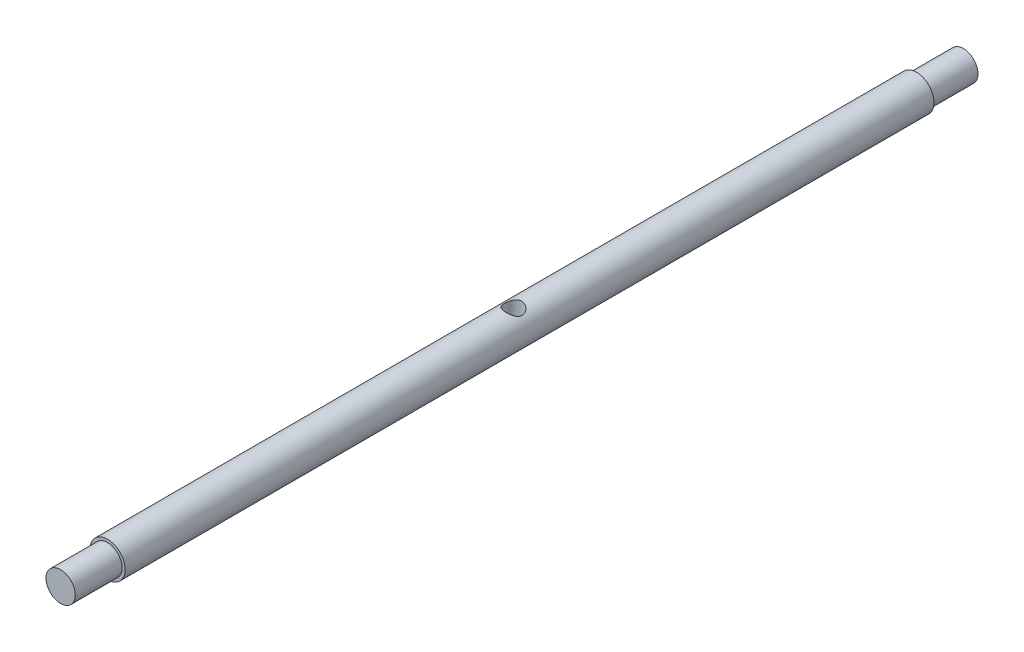
from build123d import *

# Parameters (mm, degrees)
SKETCH1_R                           = 3
BOSS_EXTRUDE1_DEPTH                 = 138
SKETCH2_R                           = 2.5
BOSS_EXTRUDE2_DEPTH                 = 8
BOSS_EXTRUDE3_START                 = 8
SKETCH3_R                           = 2.5
BOSS_EXTRUDE3_DEPTH                 = 8
CUT_EXTRUDE1_REACH                  = 148.062
CUT_EXTRUDE1_END_RADIUS             = 3
SKETCH4_R                           = 1.5
CUT_EXTRUDE1_DIRECTION_2_REACH      = 148.062
CUT_EXTRUDE1_DIRECTION_2_END_RADIUS = 3


with BuildPart() as part:
    # Sketch1 → Boss-Extrude1 (new body)
    with BuildSketch(Plane.XY):
        Circle(SKETCH1_R)
    extrude(amount=BOSS_EXTRUDE1_DEPTH)

    # Sketch2 → Boss-Extrude2 (add)
    with BuildSketch(Plane.XY.offset(138)):
        Circle(SKETCH2_R)
    extrude(amount=BOSS_EXTRUDE2_DEPTH)

    # Sketch3 → Boss-Extrude3 (add)
    with BuildSketch(Plane(origin=(0, 0, 0), x_dir=(-1, 0, 0), z_dir=(0, 0, -1)).offset(BOSS_EXTRUDE3_START)):
        with Locations(Location((0, 0, 0), (0, 0, 180))):
            Circle(SKETCH3_R)
    extrude(amount=-BOSS_EXTRUDE3_DEPTH)

    # Cut-Extrude1: up to this cylinder (the profile starts inside it)
    cut_extrude1_end = Plane(origin=(0, 0, 69), z_dir=(0, 0, -1)) * Cylinder(CUT_EXTRUDE1_END_RADIUS, 303.124, mode=Mode.PRIVATE)
    # Sketch4 → Cut-Extrude1 (cut, up to the surface)
    with BuildSketch(Plane(origin=(0, 0, 0), x_dir=(1, 0, 0), z_dir=(0, 1, 0)), mode=Mode.PRIVATE) as cut_extrude1_sk1:
        with Locations(Location((0.25, -69, 0), (0, 0, 270))):
            Circle(SKETCH4_R)
    cut_extrude1_tool1 = extrude(cut_extrude1_sk1.sketch, amount=-CUT_EXTRUDE1_REACH, mode=Mode.PRIVATE) & cut_extrude1_end
    add(cut_extrude1_tool1.solids().sort_by_distance((0.25, 0, 69))[0], mode=Mode.SUBTRACT)

    # Cut-Extrude1 direction 2: up to this cylinder (the profile starts inside it)
    cut_extrude1_direction_2_end = Plane(origin=(0, 0, 69), z_dir=(0, 0, -1)) * Cylinder(CUT_EXTRUDE1_DIRECTION_2_END_RADIUS, 303.124, mode=Mode.PRIVATE)
    # Sketch4 → Cut-Extrude1 direction 2 (cut, up to the surface)
    with BuildSketch(Plane(origin=(0, 0, 0), x_dir=(1, 0, 0), z_dir=(0, 1, 0)), mode=Mode.PRIVATE) as cut_extrude1_direction_2_sk1:
        with Locations(Location((0.25, -69, 0), (0, 0, 270))):
            Circle(SKETCH4_R)
    cut_extrude1_direction_2_tool1 = extrude(cut_extrude1_direction_2_sk1.sketch, amount=CUT_EXTRUDE1_DIRECTION_2_REACH, mode=Mode.PRIVATE) & cut_extrude1_direction_2_end
    add(cut_extrude1_direction_2_tool1.solids().sort_by_distance((0.25, 0, 69))[0], mode=Mode.SUBTRACT)


solid = part.part
